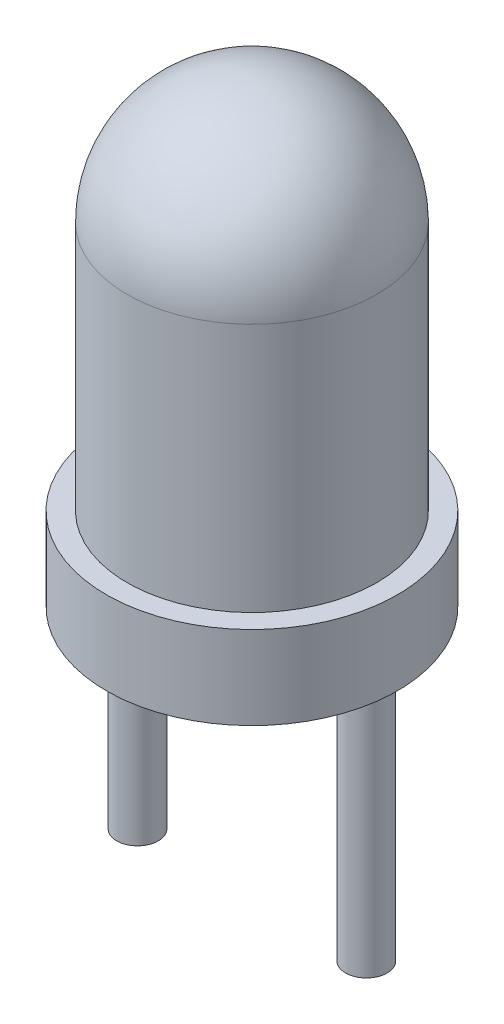
from build123d import *

# Parameters (mm, degrees)
SKETCH2_R           = 0.25
BOSS_EXTRUDE1_DEPTH = 3


with BuildPart() as part:
    # Sketch1 → Revolve1 (revolve)
    with BuildSketch(Plane.XY):
        with BuildLine():
            Line((0, 0), (-1.75, 0))
            Line((-1.75, 0), (-1.75, 1))
            Line((-1.75, 1), (-1.5, 1))
            Line((-1.5, 1), (-1.5, 4))
            ThreePointArc((-1.5, 4), (-1.060660172, 5.060660172), (0, 5.5))
            Line((0, 5.5), (0, 0))
        make_face()
    revolve(axis=Axis((0, 5.5, 0), (0, -1, 0)))

    # Sketch2 → Boss-Extrude1 (add)
    with BuildSketch(Plane.XZ):
        with Locations((-1.375, 0)):
            Circle(SKETCH2_R)
        with Locations((1.375, 0)):
            Circle(SKETCH2_R)
    extrude(amount=BOSS_EXTRUDE1_DEPTH)


solid = part.part
